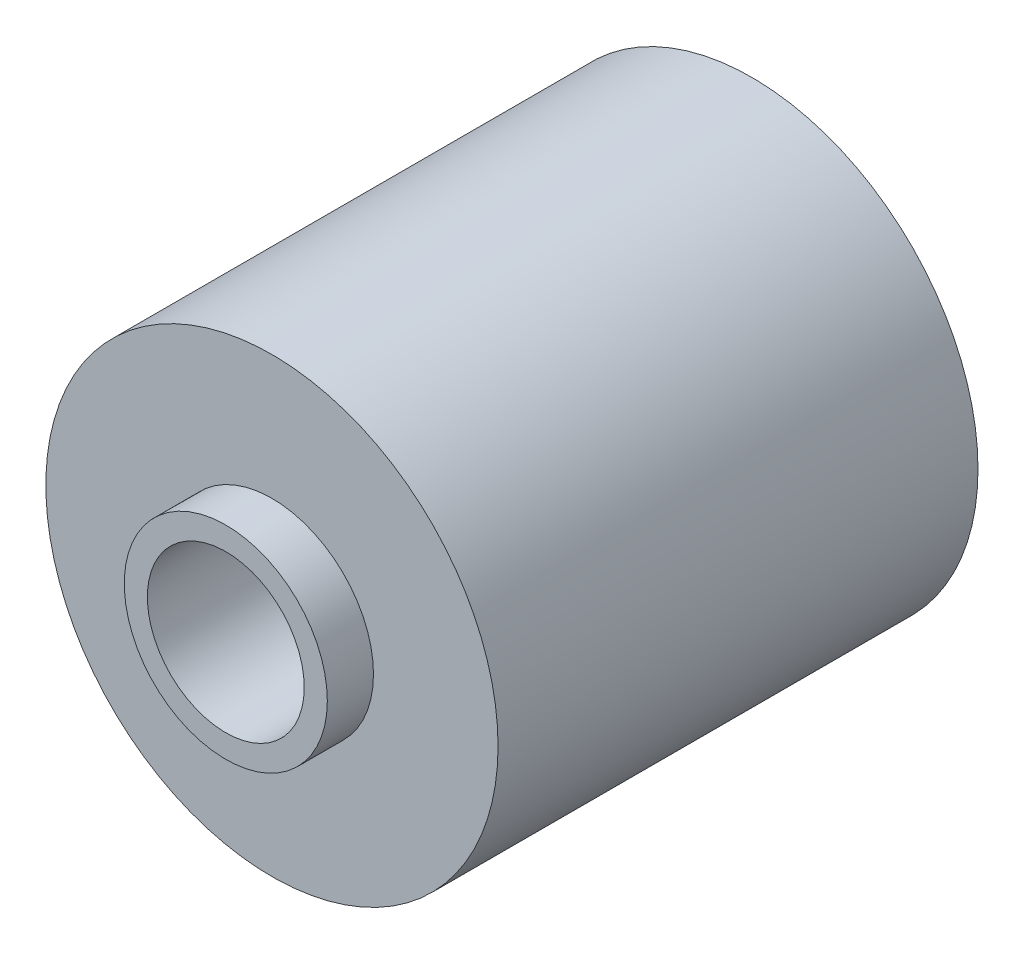
from build123d import *

# Parameters (mm, degrees)
SKETCH1_R           = 4.9
SKETCH1_R_2         = 1.7
BOSS_EXTRUDE1_DEPTH = 10.4
SKETCH2_R           = 2.2
SKETCH2_R_2         = 1.7
BOSS_EXTRUDE2_DEPTH = 1
BOSS_EXTRUDE3_START = -1
SKETCH3_R           = 2.2
SKETCH3_R_2         = 1.7
BOSS_EXTRUDE3_DEPTH = 1


with BuildPart() as part:
    # Sketch1 → Boss-Extrude1 (new body)
    with BuildSketch(Plane.XY):
        Circle(SKETCH1_R)
        Circle(SKETCH1_R_2, mode=Mode.SUBTRACT)
    extrude(amount=BOSS_EXTRUDE1_DEPTH)

    # Sketch2 → Boss-Extrude2 (add)
    with BuildSketch(Plane.XY.offset(10.4)):
        Circle(SKETCH2_R)
        Circle(SKETCH2_R_2, mode=Mode.SUBTRACT)
    extrude(amount=BOSS_EXTRUDE2_DEPTH)

    # Sketch3 → Boss-Extrude3 (add)
    with BuildSketch(Plane.XY.offset(BOSS_EXTRUDE3_START)):
        Circle(SKETCH3_R)
        Circle(SKETCH3_R_2, mode=Mode.SUBTRACT)
    extrude(amount=BOSS_EXTRUDE3_DEPTH)


solid = part.part
